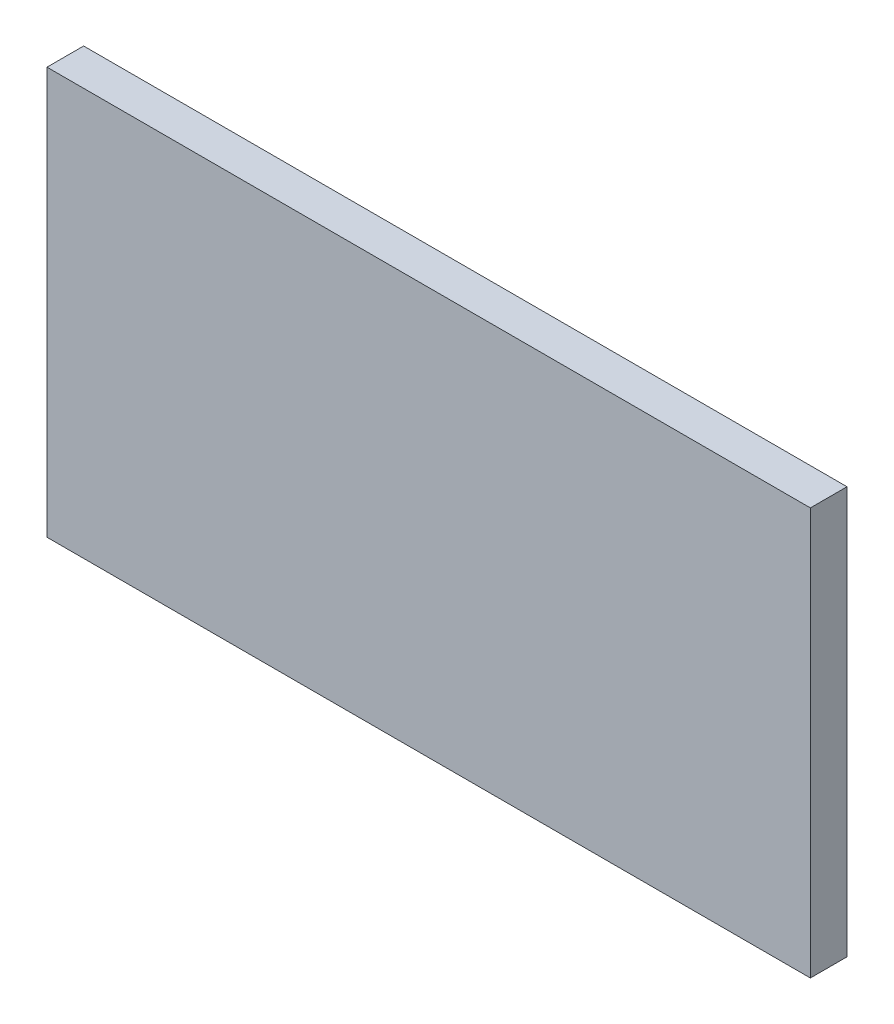
from build123d import *

# Parameters (mm, degrees)
SKPAREDCHICASUR_W   = 375
SKPAREDCHICASUR_H   = 18
PAREDCHICASUR_DEPTH = 200


with BuildPart() as part:
    # SkParedChicaSur → ParedChicaSur (new body)
    with BuildSketch(Plane(origin=(0, 50, 0), x_dir=(1, 0, 0), z_dir=(0, 1, 0))):
        with Locations((0, 196.5)):
            Rectangle(SKPAREDCHICASUR_W, SKPAREDCHICASUR_H)
    extrude(amount=PAREDCHICASUR_DEPTH)


solid = part.part
